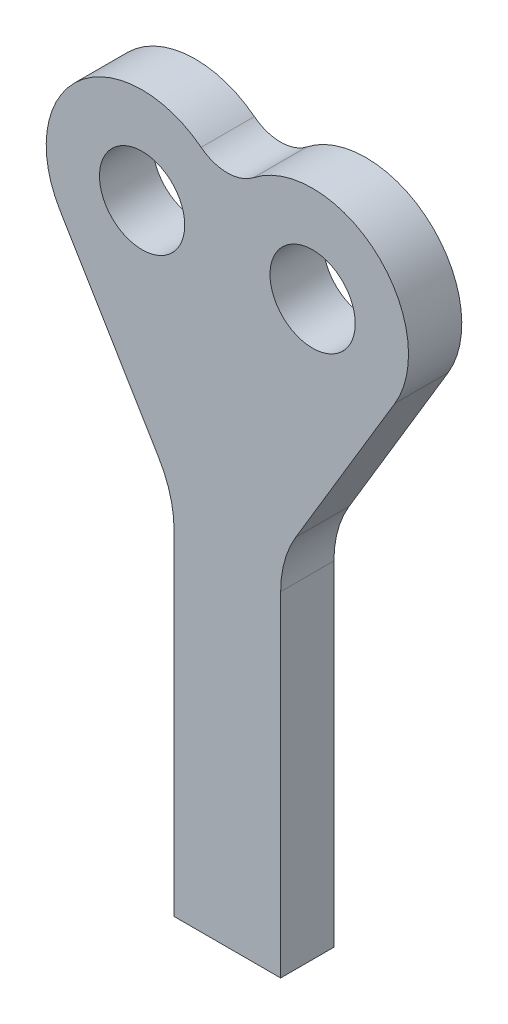
from build123d import *

# Parameters (mm, degrees)
SKETCH1_R           = 2.54
BOSS_EXTRUDE1_DEPTH = 3.175


with BuildPart() as part:
    # Sketch1 → Boss-Extrude1 (new body)
    with BuildSketch(Plane.XY):
        with BuildLine():
            Line((-9.982299112, -2.937462922), (-4.078000987, -12.791080219))
            ThreePointArc((-4.078000987, -12.791080219), (-3.40491243, -14.361697822), (-3.175, -16.05492791))
            Line((-3.175, -16.05492791), (-3.175, -35.993911504))
            Line((-3.175, -35.993911504), (3.175, -35.993911504))
            Line((3.175, -35.993911504), (3.175, -16.05492791))
            ThreePointArc((3.175, -16.05492791), (3.40491243, -14.361697822), (4.078000987, -12.791080219))
            Line((4.078000987, -12.791080219), (9.982299112, -2.937462922))
            ThreePointArc((9.982299112, -2.937462922), (8.865013598, 4.281926793), (1.563076923, 4.504717202))
            ThreePointArc((1.563076923, 4.504717202), (0, 3.966813736), (-1.563076923, 4.504717202))
            ThreePointArc((-1.563076923, 4.504717202), (-8.865013598, 4.281926793), (-9.982299112, -2.937462922))
        make_face()
        with Locations((5.08, 0)):
            Circle(SKETCH1_R, mode=Mode.SUBTRACT)
        with Locations((-5.08, 0)):
            Circle(SKETCH1_R, mode=Mode.SUBTRACT)
    extrude(amount=BOSS_EXTRUDE1_DEPTH)


solid = part.part
